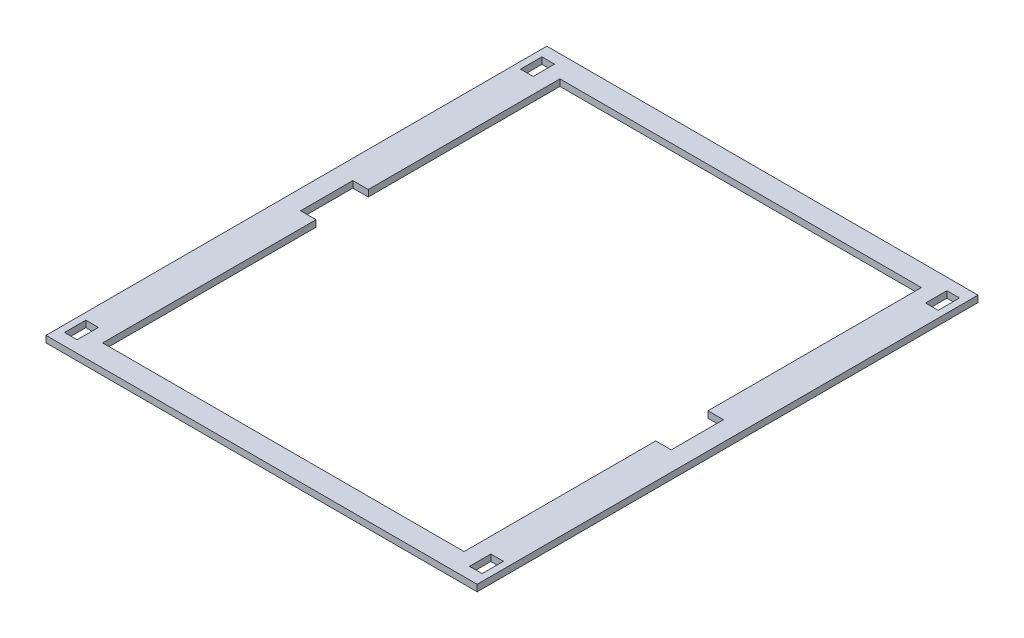
from build123d import *

# Parameters (mm, degrees)
SKETCH1_W           = 198
SKETCH1_H           = 230
SKETCH1_W_2         = 166
SKETCH1_H_2         = 210
BOSS_EXTRUDE1_DEPTH = 3
SKETCH2_W           = 7.09740754
SKETCH2_H           = 24
SKETCH2_W_2         = 5.8
SKETCH2_H_2         = 9.8
CUT_EXTRUDE1_DEPTH  = 3


with BuildPart() as part:
    # Sketch1 → Boss-Extrude1 (new body)
    with BuildSketch(Plane(origin=(0, 0, 0), x_dir=(1, 0, 0), z_dir=(0, 1, 0))):
        with Locations((99, 115)):
            Rectangle(SKETCH1_W, SKETCH1_H)
        with Locations((99, 115)):
            Rectangle(SKETCH1_W_2, SKETCH1_H_2, mode=Mode.SUBTRACT)
    extrude(amount=BOSS_EXTRUDE1_DEPTH)

    # Sketch2 → Cut-Extrude1 (cut)
    with BuildSketch(Plane(origin=(0, 3, 0), x_dir=(1, 0, 0), z_dir=(0, 1, 0))):
        with Locations((12.45129623, 120)):
            Rectangle(SKETCH2_W, SKETCH2_H)
        with Locations((191.99740754, 10.279523389)):
            Rectangle(SKETCH2_W_2, SKETCH2_H_2)
        with Locations((185.54870377, 110)):
            Rectangle(SKETCH2_W, SKETCH2_H)
        with Locations((191.99740754, 219.720476611)):
            Rectangle(SKETCH2_W_2, SKETCH2_H_2)
        with Locations((6.00259246, 219.720476611)):
            Rectangle(SKETCH2_W_2, SKETCH2_H_2)
        with Locations((6.00259246, 10.279523389)):
            Rectangle(SKETCH2_W_2, SKETCH2_H_2)
    extrude(amount=-CUT_EXTRUDE1_DEPTH, mode=Mode.SUBTRACT)


solid = part.part
